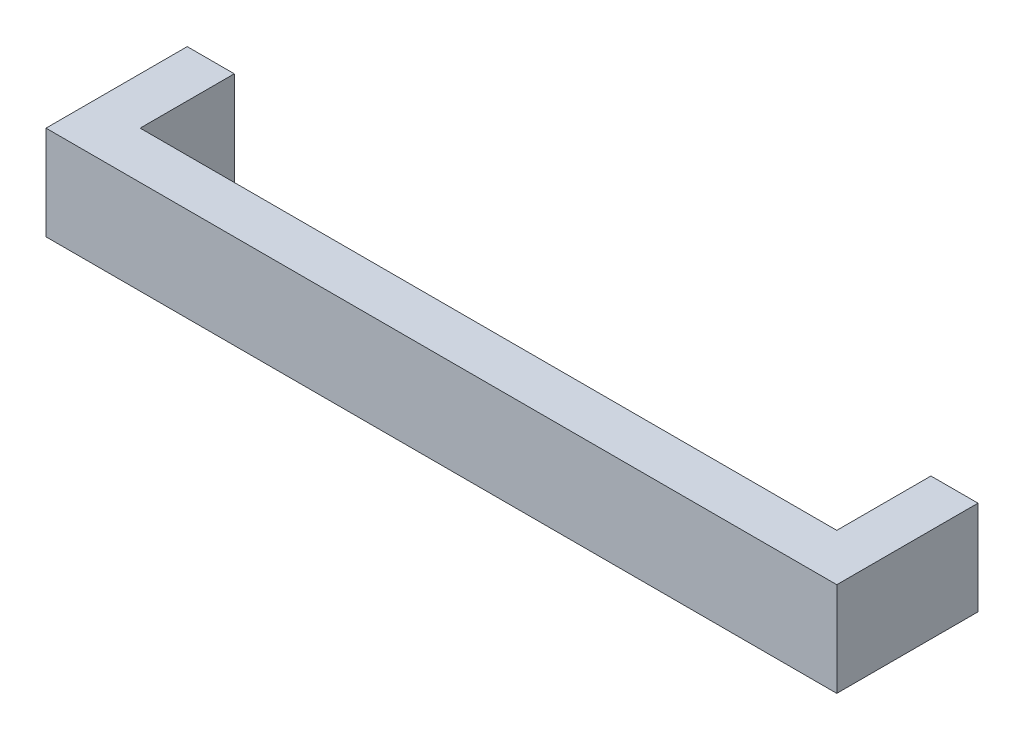
from build123d import *

# Parameters (mm, degrees)
EXTRUDE_THIN1_DEPTH = 10


with BuildPart() as part:
    # Sketch1 → Extrude-Thin1 (new body)
    with BuildSketch(Plane(origin=(0, 0, 0), x_dir=(1, 0, 0), z_dir=(0, 1, 0))):
        Polygon((0, 10), (0, 0), (74, 0), (74, 10), (79, 10), (79, -5), (-5, -5), (-5, 10), align=None)
    extrude(amount=EXTRUDE_THIN1_DEPTH)


solid = part.part
